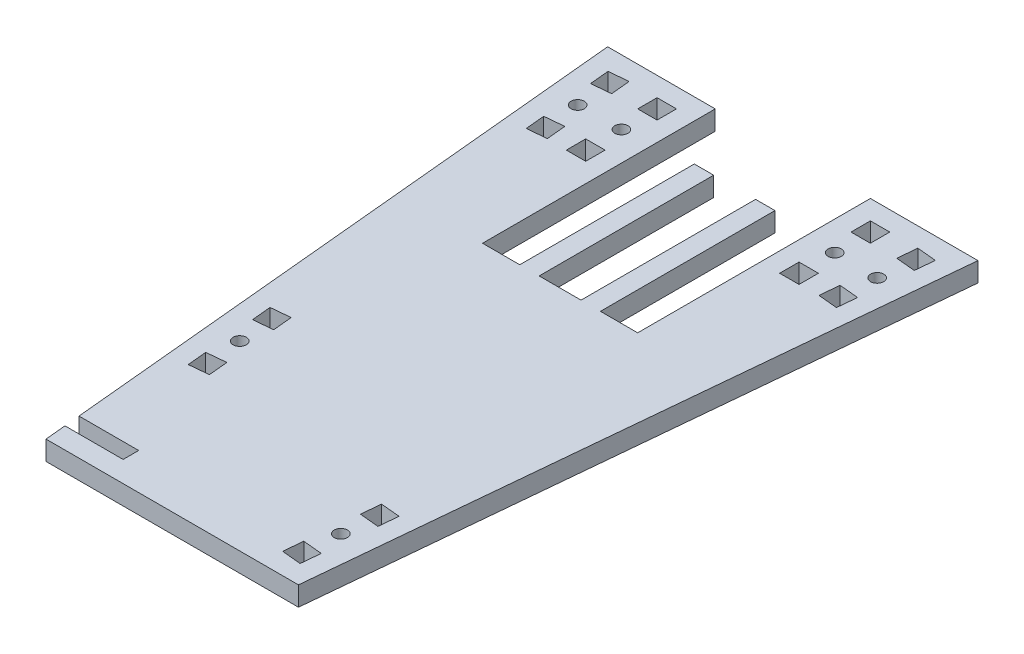
from build123d import *

# Parameters (mm, degrees)
SKETCH1_R           = 2.159
SKETCH1_W           = 6.35
SKETCH1_H           = 6.35
BOSS_EXTRUDE1_DEPTH = 6.35


with BuildPart() as part:
    # Sketch1 → Boss-Extrude1 (new body)
    with BuildSketch(Plane(origin=(0, 0, 0), x_dir=(1, 0, 0), z_dir=(0, 1, 0))):
        Polygon((-25.4, 76.2), (-47.875911854, 76.2), (-60.633073629, 76.2), (-42.466090347, -115.062), (-22.93356755, -115.062), (-22.93356755, -120.142), (-41.98356755, -120.142), (-41.332161775, -127), (-28.575, -127), (0, -127), (28.575, -127), (41.332161775, -127), (60.633073629, 76.2), (47.875911854, 76.2), (25.4, 76.2), (25.4, 0), (13.208, 0), (13.208, 57.15), (6.858, 57.15), (6.858, 0), (-6.858, 0), (-6.858, 57.15), (-13.208, 57.15), (-13.208, 0), (-25.4, 0), align=None)
        Polygon((-39.17295277, -82.578452823), (-39.773403679, -76.256905647), (-33.451856503, -75.656454737), (-32.851405593, -81.978001914), align=None, mode=Mode.SUBTRACT)
        with Locations(Location((-37.41723431, -67.485806976, 0), (0, 0, 270))):
            Circle(SKETCH1_R, mode=Mode.SUBTRACT)
        Polygon((-35.66151585, -52.393161128), (-35.061064941, -58.714708304), (-41.382612117, -59.315159214), (-41.983063027, -52.993612037), align=None, mode=Mode.SUBTRACT)
        Polygon((29.83293553, -113.756454737), (36.154482707, -114.356905647), (35.554031797, -120.678452823), (29.232484621, -120.078001914), align=None, mode=Mode.SUBTRACT)
        with Locations(Location((33.798313337, -105.585806976, 0), (0, 0, 270))):
            Circle(SKETCH1_R, mode=Mode.SUBTRACT)
        Polygon((37.763691145, -97.415159214), (31.442143968, -96.814708304), (32.042594878, -90.493161128), (38.364142054, -91.093612037), align=None, mode=Mode.SUBTRACT)
        Polygon((-50.786897864, 39.693161128), (-51.387348774, 46.014708304), (-45.065801597, 46.615159214), (-44.465350687, 40.293612037), align=None, mode=Mode.SUBTRACT)
        with Locations((-34.925, 43.307)):
            Rectangle(SKETCH1_W, SKETCH1_H, mode=Mode.SUBTRACT)
        with Locations(Location((-49.031179404, 54.785806976, 0), (0, 0, 270))):
            Circle(SKETCH1_R, mode=Mode.SUBTRACT)
        Polygon((-47.275460944, 69.878452823), (-46.675010035, 63.556905647), (-52.996557211, 62.956454737), (-53.597008121, 69.278001914), align=None, mode=Mode.SUBTRACT)
        with Locations(Location((-34.925, 54.991, 0), (0, 0, 270))):
            Circle(SKETCH1_R, mode=Mode.SUBTRACT)
        with Locations((-34.925, 66.675)):
            Rectangle(SKETCH1_W, SKETCH1_H, mode=Mode.SUBTRACT)
        with Locations((34.925, 43.307)):
            Rectangle(SKETCH1_W, SKETCH1_H, mode=Mode.SUBTRACT)
        Polygon((45.065801597, 46.615159214), (51.387348774, 46.014708304), (50.786897864, 39.693161128), (44.465350687, 40.293612037), align=None, mode=Mode.SUBTRACT)
        with Locations(Location((34.925, 54.991, 0), (0, 0, 270))):
            Circle(SKETCH1_R, mode=Mode.SUBTRACT)
        with Locations((34.925, 66.675)):
            Rectangle(SKETCH1_W, SKETCH1_H, mode=Mode.SUBTRACT)
        with Locations(Location((49.031179404, 54.785806976, 0), (0, 0, 270))):
            Circle(SKETCH1_R, mode=Mode.SUBTRACT)
        Polygon((52.996557211, 62.956454737), (46.675010035, 63.556905647), (47.275460944, 69.878452823), (53.597008121, 69.278001914), align=None, mode=Mode.SUBTRACT)
    extrude(amount=BOSS_EXTRUDE1_DEPTH)


solid = part.part
